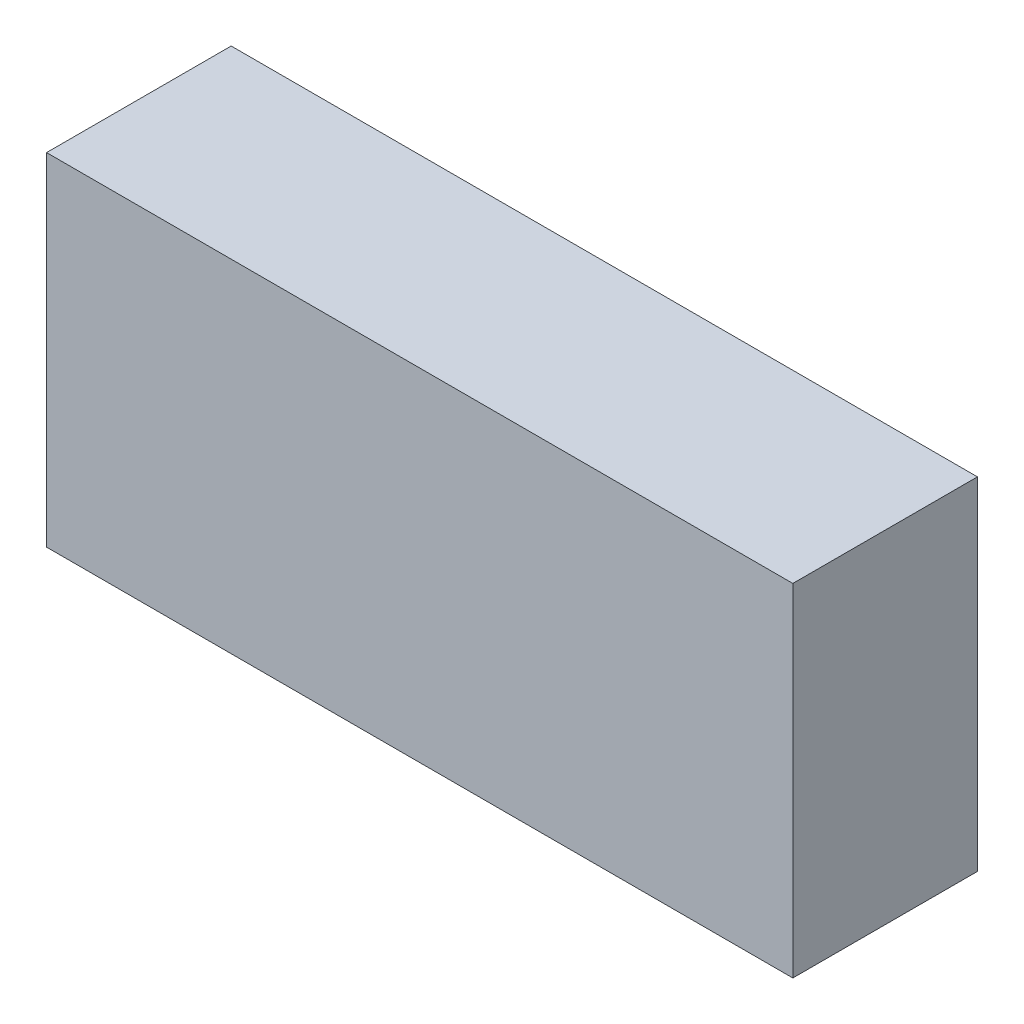
from build123d import *

# Parameters (mm, degrees)
SKETCH1_W           = 95
SKETCH1_H           = 23.5
BOSS_EXTRUDE1_DEPTH = 43.5


with BuildPart() as part:
    # Sketch1 → Boss-Extrude1 (new body)
    with BuildSketch(Plane(origin=(0, 0, 0), x_dir=(1, 0, 0), z_dir=(0, 1, 0))):
        Rectangle(SKETCH1_W, SKETCH1_H)
    extrude(amount=BOSS_EXTRUDE1_DEPTH)


solid = part.part
